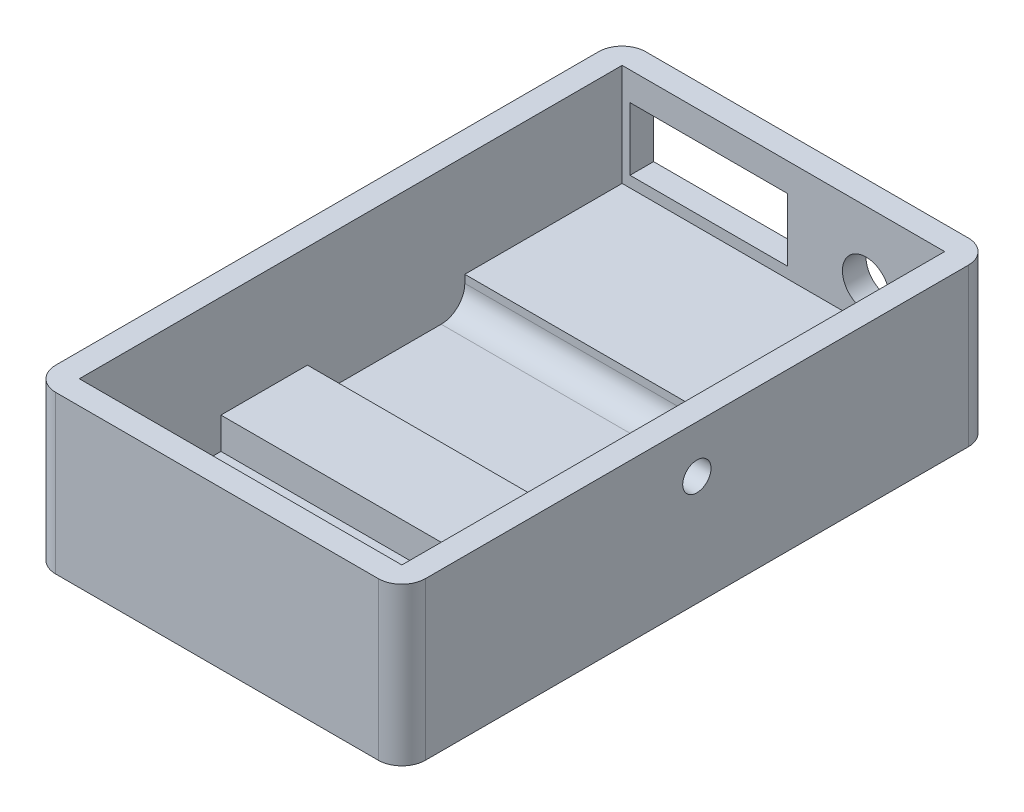
from build123d import *

# Parameters (mm, degrees)
SKETCH_2_W          = 23.5
SKETCH_2_H          = 37.5
EXTRUDE_1_DEPTH     = 10
SHELL_1_T           = -1.5
FILLET_1_R          = 1.5
SKETCH_3_W          = 20.5
SKETCH_3_H          = 25.5
EXTRUDE_2_DEPTH     = 2
SKETCH_4_W          = 20.5
SKETCH_4_H          = 10
CUT_EXTRUDE_1_DEPTH = 2
FILLET_2_R          = 1.5
SKETCH_6_W          = 10
SKETCH_6_H          = 4
CUT_EXTRUDE_2_DEPTH = 2
SKETCH_7_R          = 1.5
CUT_EXTRUDE_3_DEPTH = 2
SKETCH_8_R          = 0.9
CUT_EXTRUDE_4_DEPTH = 3
SKETCH_9_R          = 0.9
CUT_EXTRUDE_5_DEPTH = 3


with BuildPart() as part:
    # 草图2 → 凸台-拉伸1 (new body)
    with BuildSketch(Plane(origin=(0, 0, 0), x_dir=(1, 0, 0), z_dir=(0, 1, 0))):
        Rectangle(SKETCH_2_W, SKETCH_2_H)
    extrude(amount=EXTRUDE_1_DEPTH)

    # 抽壳1
    shell_1_openings = [part.faces().sort_by_distance(p)[0] for p in [
        (0, 10, 0),
    ]]
    offset(amount=SHELL_1_T, openings=shell_1_openings, kind=Kind.INTERSECTION)

    # 圆角1
    fillet_1_edges = [part.edges().sort_by_distance(p)[0] for p in [
        (-11.75, 5, -18.75),
        (11.75, 5, -18.75),
        (11.75, 5, 18.75),
        (-11.75, 5, 18.75),
    ]]
    fillet(fillet_1_edges, radius=FILLET_1_R)

    # 草图3 → 凸台-拉伸2 (add)
    with BuildSketch(Plane(origin=(0, 1.5, 0), x_dir=(1, 0, 0), z_dir=(0, 1, 0))):
        with Locations((0, 4.5)):
            Rectangle(SKETCH_3_W, SKETCH_3_H)
    extrude(amount=EXTRUDE_2_DEPTH)

    # 草图4 → 切除-拉伸1 (cut)
    with BuildSketch(Plane(origin=(0, 3.5, 0), x_dir=(1, 0, 0), z_dir=(0, 1, 0))):
        with Locations((0, 2.25)):
            Rectangle(SKETCH_4_W, SKETCH_4_H)
    extrude(amount=-CUT_EXTRUDE_1_DEPTH, mode=Mode.SUBTRACT)

    # 圆角2
    fillet_2_edges = [part.edges().sort_by_distance(p)[0] for p in [
        (0, 1.5, -7.25),
        (0, 1.5, 2.75),
    ]]
    fillet(fillet_2_edges, radius=FILLET_2_R)

    # 草图6 → 切除-拉伸2 (cut)
    with BuildSketch(Plane(origin=(0, 0, -18.75), x_dir=(-1, 0, 0), z_dir=(0, 0, -1))):
        with Locations((4.75, 6.2)):
            Rectangle(SKETCH_6_W, SKETCH_6_H)
    extrude(amount=-CUT_EXTRUDE_2_DEPTH, mode=Mode.SUBTRACT)

    # 草图7 → 切除-拉伸3 (cut)
    with BuildSketch(Plane(origin=(0, 0, -18.75), x_dir=(-1, 0, 0), z_dir=(0, 0, -1))):
        with Locations((-5.25, 5.7)):
            Circle(SKETCH_7_R)
    extrude(amount=-CUT_EXTRUDE_3_DEPTH, mode=Mode.SUBTRACT)

    # 草图8 → 切除-拉伸4 (cut)
    with BuildSketch(Plane(origin=(0, 3.5, 0), x_dir=(1, 0, 0), z_dir=(0, 1, 0))):
        with Locations(Location((7.85, 10.85, 0), (0, 0, 270))):
            Circle(SKETCH_8_R)
    extrude(amount=-CUT_EXTRUDE_4_DEPTH, mode=Mode.SUBTRACT)

    # 草图9 → 切除-拉伸5 (cut)
    with BuildSketch(Plane(origin=(11.75, 0, 0), x_dir=(0, 0, -1), z_dir=(1, 0, 0))):
        with Locations((0, 7)):
            Circle(SKETCH_9_R)
    extrude(amount=-CUT_EXTRUDE_5_DEPTH, mode=Mode.SUBTRACT)


solid = part.part
